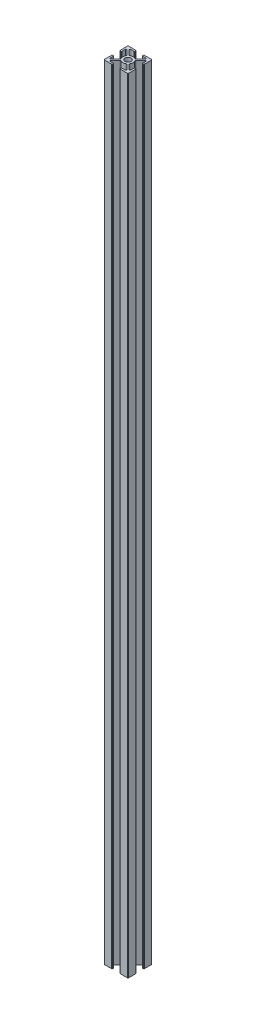
from build123d import *

# Parameters (mm, degrees)
SKETCH1_R           = 2.5
BOSS_EXTRUDE1_DEPTH = 650


with BuildPart() as part:
    # Sketch1 → Boss-Extrude1 (new body)
    with BuildSketch(Plane(origin=(0, 0, 0), x_dir=(1, 0, 0), z_dir=(0, 1, 0))):
        with BuildLine():
            Line((-6.247396549, 8.6), (-3.6, 8.6))
            ThreePointArc((-3.6, 8.6), (-3.317157288, 8.717157288), (-3.2, 9))
            Line((-3.2, 9), (-3.2, 9.6))
            ThreePointArc((-3.2, 9.6), (-3.317157288, 9.882842712), (-3.6, 10))
            Line((-3.6, 10), (-9.5, 10))
            ThreePointArc((-9.5, 10), (-9.853553391, 9.853553391), (-10, 9.5))
            Line((-10, 9.5), (-10, 3.6))
            ThreePointArc((-10, 3.6), (-9.882842712, 3.317157288), (-9.6, 3.2))
            Line((-9.6, 3.2), (-9, 3.2))
            ThreePointArc((-9, 3.2), (-8.717157288, 3.317157288), (-8.6, 3.6))
            Line((-8.6, 3.6), (-8.6, 6.402943725))
            ThreePointArc((-8.6, 6.402943725), (-8.291341716, 6.864883491), (-7.746446609, 6.756497116))
            Line((-7.746446609, 6.756497116), (-3.744782433, 2.75483294))
            ThreePointArc((-3.744782433, 2.75483294), (-3.602407081, 2.46495593), (-3.666932053, 2.148513281))
            ThreePointArc((-3.666932053, 2.148513281), (-4.25, 0), (-3.666932053, -2.148513281))
            ThreePointArc((-3.666932053, -2.148513281), (-3.602407081, -2.46495593), (-3.744782433, -2.75483294))
            Line((-3.744782433, -2.75483294), (-7.636458146, -6.646508652))
            ThreePointArc((-7.636458146, -6.646508652), (-8.251568164, -6.768861642), (-8.6, -6.247396549))
            Line((-8.6, -6.247396549), (-8.6, -3.6))
            ThreePointArc((-8.6, -3.6), (-8.717157288, -3.317157288), (-9, -3.2))
            Line((-9, -3.2), (-9.6, -3.2))
            ThreePointArc((-9.6, -3.2), (-9.882842712, -3.317157288), (-10, -3.6))
            Line((-10, -3.6), (-10, -9.5))
            ThreePointArc((-10, -9.5), (-9.853553391, -9.853553391), (-9.5, -10))
            Line((-9.5, -10), (-3.6, -10))
            ThreePointArc((-3.6, -10), (-3.317157288, -9.882842712), (-3.2, -9.6))
            Line((-3.2, -9.6), (-3.2, -9))
            ThreePointArc((-3.2, -9), (-3.317157288, -8.717157288), (-3.6, -8.6))
            Line((-3.6, -8.6), (-6.247396549, -8.6))
            ThreePointArc((-6.247396549, -8.6), (-6.768861642, -8.251568164), (-6.646508652, -7.636458146))
            Line((-6.646508652, -7.636458146), (-2.75483294, -3.744782433))
            ThreePointArc((-2.75483294, -3.744782433), (-2.46495593, -3.602407081), (-2.148513281, -3.666932053))
            ThreePointArc((-2.148513281, -3.666932053), (0, -4.25), (2.148513281, -3.666932053))
            ThreePointArc((2.148513281, -3.666932053), (2.46495593, -3.602407081), (2.75483294, -3.744782433))
            Line((2.75483294, -3.744782433), (6.646508652, -7.636458146))
            ThreePointArc((6.646508652, -7.636458146), (6.768861642, -8.251568164), (6.247396549, -8.6))
            Line((6.247396549, -8.6), (3.6, -8.6))
            ThreePointArc((3.6, -8.6), (3.317157288, -8.717157288), (3.2, -9))
            Line((3.2, -9), (3.2, -9.6))
            ThreePointArc((3.2, -9.6), (3.317157288, -9.882842712), (3.6, -10))
            Line((3.6, -10), (9.5, -10))
            ThreePointArc((9.5, -10), (9.853553391, -9.853553391), (10, -9.5))
            Line((10, -9.5), (10, -3.6))
            ThreePointArc((10, -3.6), (9.882842712, -3.317157288), (9.6, -3.2))
            Line((9.6, -3.2), (9, -3.2))
            ThreePointArc((9, -3.2), (8.717157288, -3.317157288), (8.6, -3.6))
            Line((8.6, -3.6), (8.6, -6.247396549))
            ThreePointArc((8.6, -6.247396549), (8.251568164, -6.768861642), (7.636458146, -6.646508652))
            Line((7.636458146, -6.646508652), (3.744782433, -2.75483294))
            ThreePointArc((3.744782433, -2.75483294), (3.602407081, -2.46495593), (3.666932053, -2.148513281))
            ThreePointArc((3.666932053, -2.148513281), (4.25, 0), (3.666932053, 2.148513281))
            ThreePointArc((3.666932053, 2.148513281), (3.602407081, 2.46495593), (3.744782433, 2.75483294))
            Line((3.744782433, 2.75483294), (7.636458146, 6.646508652))
            ThreePointArc((7.636458146, 6.646508652), (8.251568164, 6.768861642), (8.6, 6.247396549))
            Line((8.6, 6.247396549), (8.6, 3.6))
            ThreePointArc((8.6, 3.6), (8.717157288, 3.317157288), (9, 3.2))
            Line((9, 3.2), (9.6, 3.2))
            ThreePointArc((9.6, 3.2), (9.882842712, 3.317157288), (10, 3.6))
            Line((10, 3.6), (10, 9.5))
            ThreePointArc((10, 9.5), (9.853553391, 9.853553391), (9.5, 10))
            Line((9.5, 10), (3.6, 10))
            ThreePointArc((3.6, 10), (3.317157288, 9.882842712), (3.2, 9.6))
            Line((3.2, 9.6), (3.2, 9))
            ThreePointArc((3.2, 9), (3.317157288, 8.717157288), (3.6, 8.6))
            Line((3.6, 8.6), (6.247396549, 8.6))
            ThreePointArc((6.247396549, 8.6), (6.768861642, 8.251568164), (6.646508652, 7.636458146))
            Line((6.646508652, 7.636458146), (2.75483294, 3.744782433))
            ThreePointArc((2.75483294, 3.744782433), (2.46495593, 3.602407081), (2.148513281, 3.666932053))
            ThreePointArc((2.148513281, 3.666932053), (0, 4.25), (-2.148513281, 3.666932053))
            ThreePointArc((-2.148513281, 3.666932053), (-2.46495593, 3.602407081), (-2.75483294, 3.744782433))
            Line((-2.75483294, 3.744782433), (-6.646508652, 7.636458146))
            ThreePointArc((-6.646508652, 7.636458146), (-6.768861642, 8.251568164), (-6.247396549, 8.6))
        make_face()
        with Locations(Location((0, 0, 0), (0, 0, 270))):
            Circle(SKETCH1_R, mode=Mode.SUBTRACT)
    extrude(amount=BOSS_EXTRUDE1_DEPTH)


solid = part.part
